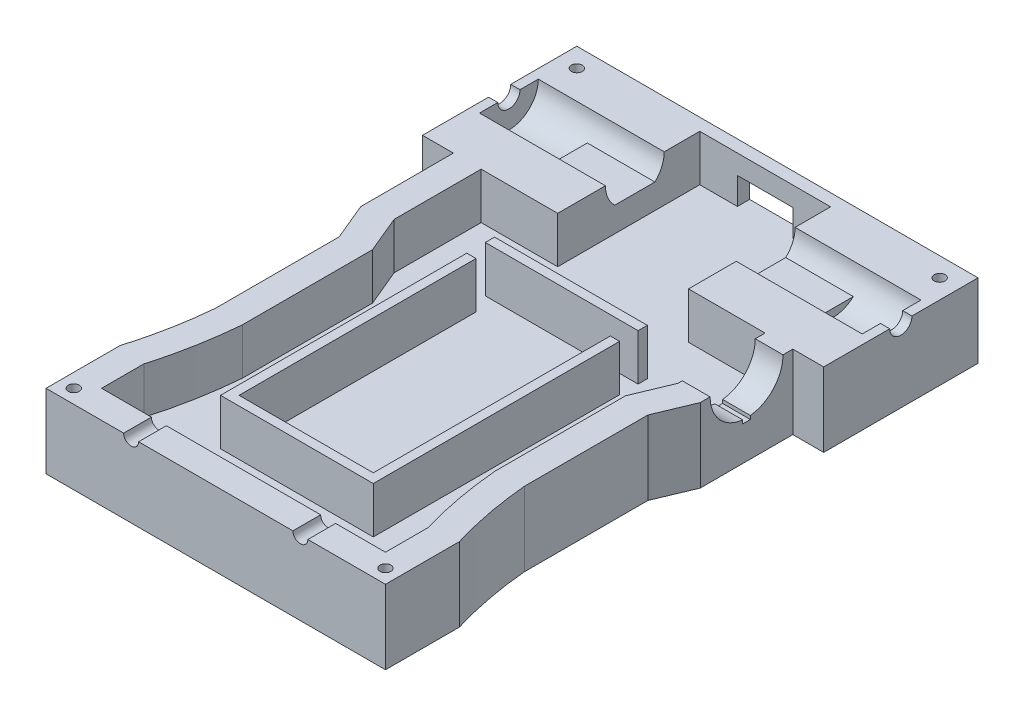
from build123d import *

# Parameters (mm, degrees)
BOSS_EXTRUDE1_DEPTH = 20.32
CUT_EXTRUDE1_DEPTH  = 12.7
SKETCH14_R          = 8.0645
CUT_EXTRUDE4_DEPTH  = 16.002
CUT_EXTRUDE5_DEPTH  = 34.544
SKETCH14_5_R        = 3.048
CUT_EXTRUDE6_DEPTH  = 157.413445344
SKETCH15_W          = 35.898582
SKETCH15_H          = 38.980588406
CUT_EXTRUDE7_DEPTH  = 17.78
SKETCH16_W          = 41.91
SKETCH16_H          = 2.54
BOSS_EXTRUDE2_DEPTH = 12.7
CUT_EXTRUDE9_DEPTH  = 11.4
SKETCH17_5_R        = 10
CUT_EXTRUDE10_DEPTH = 11.4
CUT_EXTRUDE16_DEPTH = 10
SKETCH25_W          = 35.898582
SKETCH25_H          = 38.980588406
BOSS_EXTRUDE4_DEPTH = 5.08
CUT_EXTRUDE17_START = -159.301903077
SKETCH26_R          = 3.5
SKETCH26_R_2        = 1.5
CUT_EXTRUDE17_DEPTH = 177.271903077
SKETCH26_4_R        = 1.5
CUT_EXTRUDE19_DEPTH = 159.301903077
SKETCH29_R          = 1.5
CUT_EXTRUDE20_DEPTH = 159.890064251
SKETCH30_R          = 3.25
CUT_EXTRUDE21_DEPTH = 159.390754219
CUT_EXTRUDE24_DEPTH = 62.674


with BuildPart() as part:
    # Sketch3 → Boss-Extrude1 (new body)
    with BuildSketch(Plane(origin=(0, 0, 0), x_dir=(1, 0, 0), z_dir=(0, 1, 0))):
        with BuildLine():
            Line((101.599873, 0), (110.066582, 0))
            Line((110.066582, 0), (110.066582, 42.333418))
            Line((110.066582, 42.333418), (55.033291, 42.333418))
            Line((55.033291, 42.333418), (8.4666328, 42.333418))
            Line((8.4666328, 42.333418), (0, 42.333418))
            Line((0, 42.333418), (0, 0))
            Line((0, 0), (8.4666328, 0))
            Line((8.4666328, 0), (8.4666328, -25.4))
            Line((8.4666328, -25.4), (12.6999492, -35.56))
            Line((12.6999492, -35.56), (12.6999492, -69.426582))
            add(Edge.make_bspline(
                [(12.6999492, -69.426582), (11.690404189, -80.766544706), (8.46666328, -91.44)],
                knots=[0, 0, 0, 0.504540069, 0.504540069, 0.504540069], degree=2))
            Line((8.46666328, -91.44), (8.46666328, -111.76))
            Line((8.46666328, -111.76), (101.599995682, -111.76))
            Line((101.599995682, -111.76), (101.599995682, -91.44))
            add(Edge.make_bspline(
                [(97.366709, -69.426582), (98.376270675, -80.766537876), (101.599995682, -91.44)],
                knots=[0, 0, 0, 0.504540407, 0.504540407, 0.504540407], degree=2))
            Line((97.366709, -69.426582), (97.366709, -35.56))
            Line((97.366709, -35.56), (101.599873, -25.4))
            Line((101.599873, -25.4), (101.599873, 0))
        make_face()
    extrude(amount=BOSS_EXTRUDE1_DEPTH)

    # Sketch7 → Cut-Extrude1 (cut)
    with BuildSketch(Plane(origin=(0, 20.32, 0), x_dir=(1, 0, 0), z_dir=(0, 1, 0))):
        with BuildLine():
            Line((16.0866328, 0), (93.979873, 0))
            Line((93.979873, 0), (93.979873, -23.876056271))
            Line((93.979873, -23.876056271), (89.746709, -34.036056271))
            Line((89.746709, -34.036056271), (89.746709, -69.759644388))
            add(Edge.make_bspline(
                [(89.746709, -69.759644388), (90.418698914, -77.556217584), (91.829471112, -85.161374913), (93.979995682, -92.545959033)],
                knots=[0, 0, 0, 0, 1, 1, 1, 1], degree=3))
            Line((93.979995682, -92.545959033), (93.979995682, -104.14))
            Line((93.979995682, -104.14), (16.08666328, -104.14))
            Line((16.08666328, -104.14), (16.08666328, -92.545964634))
            add(Edge.make_bspline(
                [(16.08666328, -92.545964634), (18.237198531, -85.161380775), (19.647970427, -77.556219246), (20.3199492, -69.759638641)],
                knots=[0, 0, 0, 0, 1, 1, 1, 1], degree=3))
            Line((20.3199492, -69.759638641), (20.3199492, -34.036005627))
            Line((20.3199492, -34.036005627), (16.0866328, -23.876005627))
            Line((16.0866328, -23.876005627), (16.0866328, 0))
        make_face()
    extrude(amount=-CUT_EXTRUDE1_DEPTH, mode=Mode.SUBTRACT)

    # Sketch14 → Cut-Extrude4 (cut)
    with BuildSketch(Plane.ZY.offset(-2.54)):
        with Locations((-21.166709, 20.32)):
            Circle(SKETCH14_R)
    cut_extrude4 = extrude(amount=-CUT_EXTRUDE4_DEPTH, mode=Mode.SUBTRACT)

    # Sketch14<4> → Cut-Extrude5 (cut)
    with BuildSketch(Plane.ZY.offset(-2.54)):
        with BuildLine():
            Line((-26.672257875, 14.4272), (-15.661160125, 14.4272))
            ThreePointArc((-15.661160125, 14.4272), (-21.166709, 28.3845), (-26.672257875, 14.4272))
        make_face()
    cut_extrude5 = extrude(amount=-CUT_EXTRUDE5_DEPTH, mode=Mode.SUBTRACT)

    # Sketch14<5> → Cut-Extrude6 (cut, through all)
    with BuildSketch(Plane.ZY.offset(-2.54)):
        with Locations((-21.166709, 20.32)):
            Circle(SKETCH14_5_R)
    cut_extrude6 = extrude(amount=CUT_EXTRUDE6_DEPTH, mode=Mode.SUBTRACT)

    # Mirror2: Cut-Extrude4, Cut-Extrude5, Cut-Extrude6 across plane
    add(cut_extrude4.mirror(Plane(origin=(55.033291, 0, 0), x_dir=(0, 0, 1), z_dir=(1, 0, 0))), mode=Mode.SUBTRACT)
    add(cut_extrude5.mirror(Plane(origin=(55.033291, 0, 0), x_dir=(0, 0, 1), z_dir=(1, 0, 0))), mode=Mode.SUBTRACT)
    add(cut_extrude6.mirror(Plane(origin=(55.033291, 0, 0), x_dir=(0, 0, 1), z_dir=(1, 0, 0))), mode=Mode.SUBTRACT)

    # Sketch15 → Cut-Extrude7 (cut)
    with BuildSketch(Plane(origin=(0, 20.32, 0), x_dir=(1, 0, 0), z_dir=(0, 1, 0))):
        with Locations((55.033291, 19.490294203)):
            Rectangle(SKETCH15_W, SKETCH15_H)
    extrude(amount=-CUT_EXTRUDE7_DEPTH, mode=Mode.SUBTRACT)

    # Sketch16 → Boss-Extrude2 (add)
    with BuildSketch(Plane(origin=(0, 7.62, 0), x_dir=(1, 0, 0), z_dir=(0, 1, 0))):
        with Locations((55.0333291, -15.57585033)):
            Rectangle(SKETCH16_W, SKETCH16_H)
        Polygon((75.9883291, -21.92585033), (73.4483291, -21.92585033), (73.4483291, -86.94985033), (36.6183291, -86.94985033), (36.6183291, -21.92585033), (34.0783291, -21.92585033), (34.0783291, -89.48985033), (75.9883291, -89.48985033), align=None)
    extrude(amount=BOSS_EXTRUDE2_DEPTH)

    # Sketch17 → Cut-Extrude9 (cut)
    with BuildSketch(Plane(origin=(104.139873, 0, 0), x_dir=(0, 0, -1), z_dir=(1, 0, 0))):
        with BuildLine():
            Line((-13.75, 9.42), (-12.7, 9.42))
            Line((-12.7, 9.42), (-11.65, 9.42))
            Line((-11.65, 9.42), (-11.65, 10.375277782))
            ThreePointArc((-11.65, 10.375277782), (-12.7, 10.32), (-13.75, 10.375277782))
            Line((-13.75, 10.375277782), (-13.75, 9.42))
        make_face()
    extrude(amount=-CUT_EXTRUDE9_DEPTH, mode=Mode.SUBTRACT)

    # Sketch17<5> → Cut-Extrude10 (cut)
    with BuildSketch(Plane(origin=(104.139873, 0, 0), x_dir=(0, 0, -1), z_dir=(1, 0, 0))):
        with Locations((-12.7, 20.32)):
            Circle(SKETCH17_5_R)
    extrude(amount=-CUT_EXTRUDE10_DEPTH, mode=Mode.SUBTRACT)

    # Sketch23 → Cut-Extrude16 (cut)
    with BuildSketch(Plane.XY.offset(-38.980588406)):
        Polygon((62.653291, 14.986), (62.653291, 7.62), (55.033291, 7.62), (47.413291, 7.62), (47.413291, 14.986), align=None)
    extrude(amount=-CUT_EXTRUDE16_DEPTH, mode=Mode.SUBTRACT)

    # Sketch25 → Boss-Extrude4 (add)
    with BuildSketch(Plane(origin=(0, 2.54, 0), x_dir=(1, 0, 0), z_dir=(0, 1, 0))):
        with Locations((55.033291, 19.490294203)):
            Rectangle(SKETCH25_W, SKETCH25_H)
    extrude(amount=BOSS_EXTRUDE4_DEPTH)


with BuildPart() as body_2:
    # Sketch21 → Loft3 section 0
    with BuildSketch(Plane(origin=(0, 0, 0), x_dir=(-1, 0, 0), z_dir=(0, -1, 0))):
        with BuildLine():
            Line((-8.46666328, -91.44), (-8.46666328, -111.76))
            Line((-8.46666328, -111.76), (-101.599995682, -111.76))
            Line((-101.599995682, -111.76), (-101.599995682, -91.44))
            add(Edge.make_bspline(
                [(-97.366709, -69.426582), (-98.376270675, -80.766537876), (-101.599995682, -91.44)],
                knots=[0, 0, 0, 1, 1, 1], degree=2))
            Line((-97.366709, -69.426582), (-97.366709, -35.56))
            Line((-97.366709, -35.56), (-101.599873, -25.4))
            Line((-101.599873, -25.4), (-101.599873, 0))
            Line((-101.599873, 0), (-110.066582, 0))
            Line((-110.066582, 0), (-110.066582, 42.333418))
            Line((-110.066582, 42.333418), (0, 42.333418))
            Line((0, 42.333418), (0, 0))
            Line((0, 0), (-8.4666328, 0))
            Line((-8.4666328, 0), (-8.4666328, -25.4))
            Line((-8.4666328, -25.4), (-12.6999492, -35.56))
            Line((-12.6999492, -35.56), (-12.6999492, -69.426582))
            add(Edge.make_bspline(
                [(-12.6999492, -69.426582), (-11.690404189, -80.766544706), (-8.46666328, -91.44)],
                knots=[0, 0, 0, 1, 1, 1], degree=2))
        make_face()
    # Sketch20 → Loft3 section 1
    with BuildSketch(Plane(origin=(0, -4.999999906, 0), x_dir=(-1, 0, 0), z_dir=(0, -1, 0))):
        with BuildLine():
            Line((-16.0866328, 7.62), (-7.62, 7.62))
            Line((-7.62, 7.62), (-7.62, 34.713418))
            Line((-7.62, 34.713418), (-102.446582, 34.713418))
            Line((-102.446582, 34.713418), (-102.446582, 7.62))
            Line((-102.446582, 7.62), (-93.979873, 7.62))
            Line((-93.979873, 7.62), (-93.979873, -23.876056271))
            Line((-93.979873, -23.876056271), (-89.746709, -34.036056271))
            Line((-89.746709, -34.036056271), (-89.746709, -69.759644389))
            add(Edge.make_bspline(
                [(-89.746709, -69.759644389), (-90.413284724, -77.493400974), (-91.809170303, -85.091664929), (-93.979995682, -92.545959033)],
                knots=[0, 0, 0, 0, 1, 1, 1, 1], degree=3))
            Line((-93.979995682, -92.545959033), (-93.979995682, -104.14))
            Line((-93.979995682, -104.14), (-16.08666328, -104.14))
            Line((-16.08666328, -104.14), (-16.08666328, -92.545964634))
            add(Edge.make_bspline(
                [(-16.08666328, -92.545964634), (-18.257500019, -85.091668809), (-19.653384668, -77.493400947), (-20.3199492, -69.75963864)],
                knots=[0, 0, 0, 0, 1, 1, 1, 1], degree=3))
            Line((-20.3199492, -69.75963864), (-20.3199492, -34.036005627))
            Line((-20.3199492, -34.036005627), (-16.0866328, -23.876005627))
            Line((-16.0866328, -23.876005627), (-16.0866328, 7.62))
        make_face()
    loft()


with BuildPart() as cut_extrude17_tool:
    # Sketch26 → Cut-Extrude17 (new body)
    with BuildSketch(Plane(origin=(0, -0.999999906, 0), x_dir=(1, 0, 0), z_dir=(0, 1, 0)).offset(CUT_EXTRUDE17_START)):
        with Locations(Location((5.259533714, 37.073884286, 0), (0, 0, 270))):
            Circle(SKETCH26_R)
        with Locations(Location((5.259533714, 37.073884286, 0), (0, 0, 270))):
            Circle(SKETCH26_R_2, mode=Mode.SUBTRACT)
    cut_extrude17 = extrude(amount=CUT_EXTRUDE17_DEPTH)


with BuildPart() as part_1:
    add(part.part)

    # Cut-Extrude17: cut by cut_extrude17_tool
    add(cut_extrude17_tool.part, mode=Mode.SUBTRACT)


with BuildPart() as body_2_1:
    add(body_2.part)

    # Cut-Extrude17: cut by cut_extrude17_tool
    add(cut_extrude17_tool.part, mode=Mode.SUBTRACT)


with BuildPart() as cut_extrude19_tool:
    # Sketch26<4> → Cut-Extrude19 (new, symmetric)
    with BuildSketch(Plane(origin=(0, -0.999999906, 0), x_dir=(1, 0, 0), z_dir=(0, 1, 0))):
        with Locations(Location((5.259533714, 37.073884286, 0), (0, 0, 270))):
            Circle(SKETCH26_4_R)
    cut_extrude19 = extrude(amount=CUT_EXTRUDE19_DEPTH, both=True)


with BuildPart() as part_2:
    add(part_1.part)

    # Cut-Extrude19: cut by cut_extrude19_tool
    add(cut_extrude19_tool.part, mode=Mode.SUBTRACT)


with BuildPart() as body_2_2:
    add(body_2_1.part)

    # Cut-Extrude19: cut by cut_extrude19_tool
    add(cut_extrude19_tool.part, mode=Mode.SUBTRACT)


with BuildPart() as mirror3_tool:
    # Mirror3: Cut-Extrude17, Cut-Extrude19 across plane
    add(cut_extrude17.mirror(Plane(origin=(55.033291, 0, 0), x_dir=(0, 0, 1), z_dir=(1, 0, 0))))
    add(cut_extrude19.mirror(Plane(origin=(55.033291, 0, 0), x_dir=(0, 0, 1), z_dir=(1, 0, 0))))


with BuildPart() as part_3:
    add(part_2.part)

    # Mirror3: cut by mirror3_tool
    add(mirror3_tool.part, mode=Mode.SUBTRACT)


with BuildPart() as body_2_3:
    add(body_2_2.part)

    # Mirror3: cut by mirror3_tool
    add(mirror3_tool.part, mode=Mode.SUBTRACT)


with BuildPart() as cut_extrude20_tool:
    # Sketch29 → Cut-Extrude20 (new, through all)
    with BuildSketch(Plane(origin=(0, 20.32, 0), x_dir=(1, 0, 0), z_dir=(0, 1, 0))):
        with Locations(Location((97.789995682, -107.95, 0), (0, 0, 270))):
            Circle(SKETCH29_R)
        with Locations(Location((12.27666328, -107.95, 0), (0, 0, 270))):
            Circle(SKETCH29_R)
    extrude(amount=-CUT_EXTRUDE20_DEPTH)


with BuildPart() as part_4:
    add(part_3.part)

    # Cut-Extrude20: cut by cut_extrude20_tool
    add(cut_extrude20_tool.part, mode=Mode.SUBTRACT)


with BuildPart() as body_2_4:
    add(body_2_3.part)

    # Cut-Extrude20: cut by cut_extrude20_tool
    add(cut_extrude20_tool.part, mode=Mode.SUBTRACT)


with BuildPart() as cut_extrude21_tool:
    # Sketch30 → Cut-Extrude21 (new, through all)
    with BuildSketch(Plane(origin=(0, 16.970000096, 0), x_dir=(1, 0, 0), z_dir=(0, 1, 0))):
        with Locations(Location((97.789995682, -107.95, 0), (0, 0, 270))):
            Circle(SKETCH30_R)
        with Locations(Location((12.27666328, -107.95, 0), (0, 0, 270))):
            Circle(SKETCH30_R)
    extrude(amount=-CUT_EXTRUDE21_DEPTH)


with BuildPart() as part_5:
    add(part_4.part)

    # Cut-Extrude21: cut by cut_extrude21_tool
    add(cut_extrude21_tool.part, mode=Mode.SUBTRACT)

    # Sketch32 → Cut-Extrude24 (cut)
    with BuildSketch(Plane.XY.offset(111.76)):
        with BuildLine():
            Line((29.766663316, 20.32), (33.866663316, 20.32))
            ThreePointArc((33.866663316, 20.32), (31.816663316, 18.27), (29.766663316, 20.32))
        make_face()
    cut_extrude24 = extrude(amount=-CUT_EXTRUDE24_DEPTH, mode=Mode.SUBTRACT)

    # Mirror8: Cut-Extrude24 across plane
    add(cut_extrude24.mirror(Plane(origin=(55.033291, 0, 0), x_dir=(0, 0, 1), z_dir=(1, 0, 0))), mode=Mode.SUBTRACT)


with BuildPart() as body_2_5:
    add(body_2_4.part)

    # Cut-Extrude21: cut by cut_extrude21_tool
    add(cut_extrude21_tool.part, mode=Mode.SUBTRACT)


solid = Compound([part_5.part, body_2_5.part])
